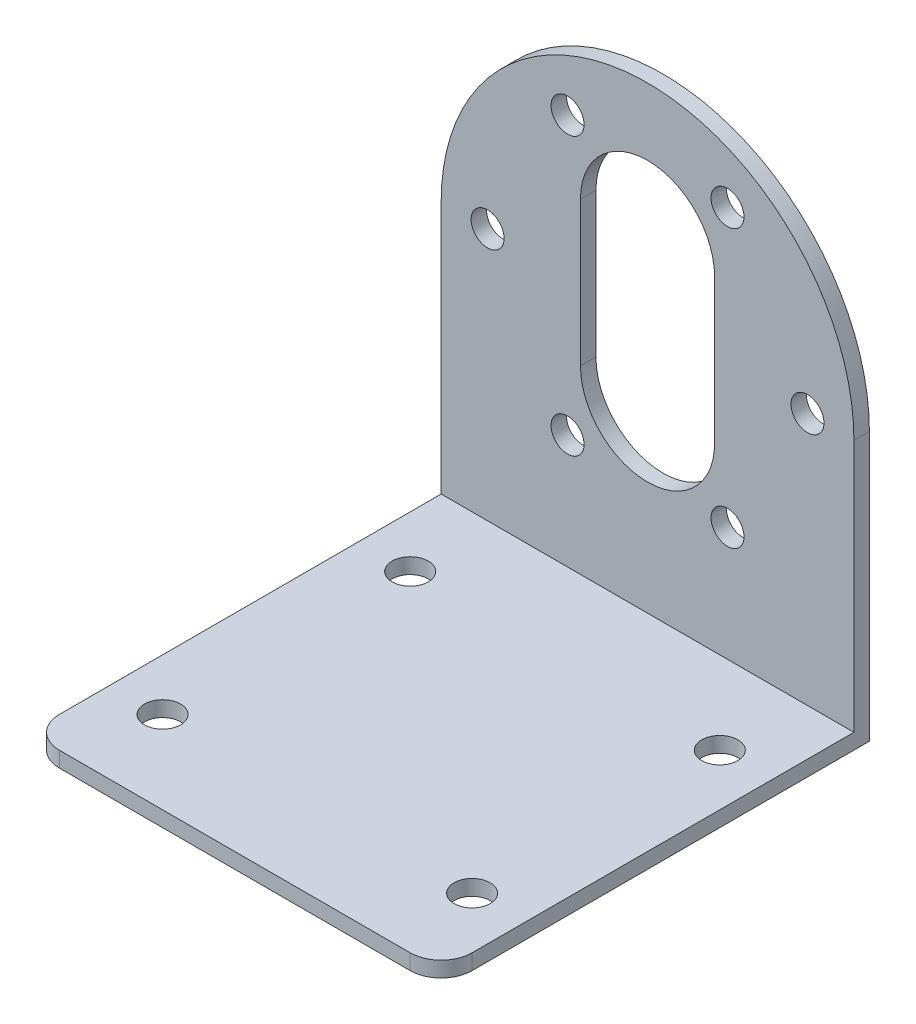
from build123d import *

# Parameters (mm, degrees)
SKETCH_1_R      = 1.75
EXTRUDE_1_DEPTH = 1.5
SKETCH_2_R      = 1.6
EXTRUDE_2_DEPTH = 1.5


with BuildPart() as part:
    # 草图1 → 凸台-拉伸1 (new body)
    with BuildSketch(Plane(origin=(0, 0, 0), x_dir=(1, 0, 0), z_dir=(0, 1, 0))):
        with BuildLine():
            Line((-20, 0), (20, 0))
            Line((20, 0), (20, -37))
            ThreePointArc((20, -37), (19.121320344, -39.121320344), (17, -40))
            Line((17, -40), (-17, -40))
            ThreePointArc((-17, -40), (-19.121320344, -39.121320344), (-20, -37))
            Line((-20, -37), (-20, 0))
        make_face()
        with Locations(Location((-15, -32, 0), (0, 0, 270))):
            Circle(SKETCH_1_R, mode=Mode.SUBTRACT)
        with Locations(Location((-15, -8, 0), (0, 0, 270))):
            Circle(SKETCH_1_R, mode=Mode.SUBTRACT)
        with Locations(Location((15, -8, 0), (0, 0, 270))):
            Circle(SKETCH_1_R, mode=Mode.SUBTRACT)
        with Locations(Location((15, -32, 0), (0, 0, 270))):
            Circle(SKETCH_1_R, mode=Mode.SUBTRACT)
    extrude(amount=EXTRUDE_1_DEPTH)

    # 草图2 → 凸台-拉伸2 (add)
    with BuildSketch(Plane.XY):
        with BuildLine():
            Line((20, 0), (-20, 0))
            Line((-20, 0), (-20, 26))
            ThreePointArc((-20, 26), (0, 46), (20, 26))
            Line((20, 26), (20, 0))
        make_face()
        with Locations((-15.5, 26)):
            Circle(SKETCH_2_R, mode=Mode.SUBTRACT)
        with Locations((-7.75, 39.423393759)):
            Circle(SKETCH_2_R, mode=Mode.SUBTRACT)
        with Locations((7.75, 39.423393759)):
            Circle(SKETCH_2_R, mode=Mode.SUBTRACT)
        with Locations((15.5, 26)):
            Circle(SKETCH_2_R, mode=Mode.SUBTRACT)
        with Locations((7.75, 12.576606241)):
            Circle(SKETCH_2_R, mode=Mode.SUBTRACT)
        with Locations((-7.75, 12.576606241)):
            Circle(SKETCH_2_R, mode=Mode.SUBTRACT)
        with BuildLine():
            Line((-6.5, 33), (-6.5, 19))
            ThreePointArc((-6.5, 19), (0, 12.5), (6.5, 19))
            Line((6.5, 19), (6.5, 33))
            ThreePointArc((6.5, 33), (0, 39.5), (-6.5, 33))
        make_face(mode=Mode.SUBTRACT)
    extrude(amount=-EXTRUDE_2_DEPTH)


solid = part.part
